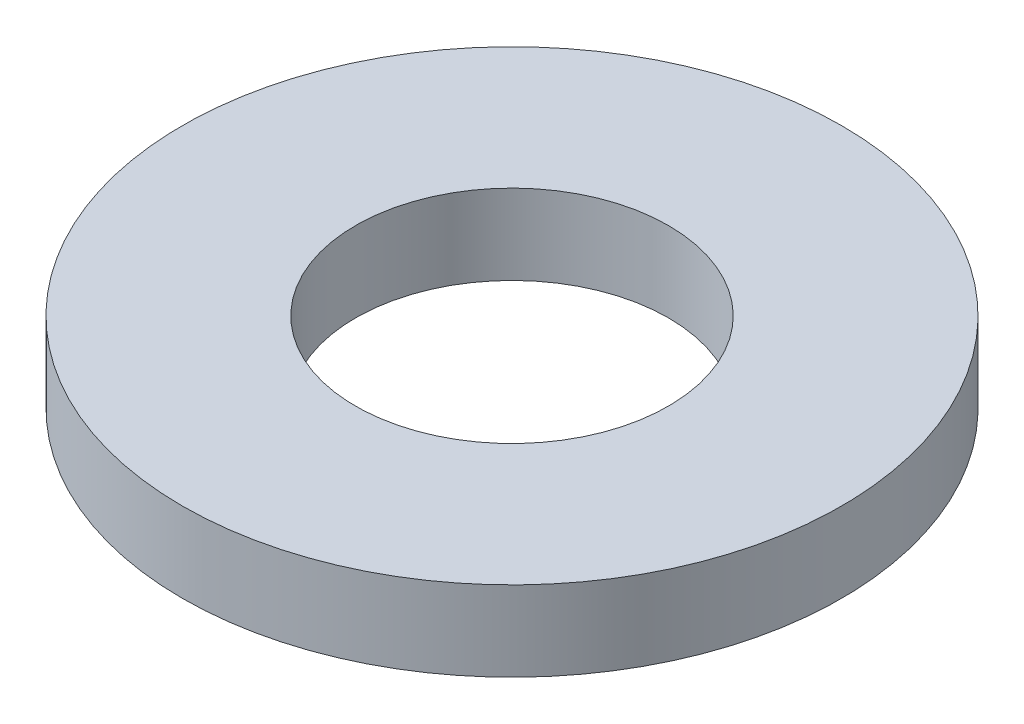
from build123d import *

# Parameters (mm, degrees)
SKETCH1_R           = 12.36
BOSS_EXTRUDE1_DEPTH = 3
SKETCH2_R           = 5.8674
CUT_EXTRUDE1_DEPTH  = 18.735253029


with BuildPart() as part:
    # Sketch1 → Boss-Extrude1 (new body)
    with BuildSketch(Plane(origin=(0, 0, 0), x_dir=(1, 0, 0), z_dir=(0, 1, 0))):
        with Locations(Location((0, 0, 0), (0, 0, 270))):
            Circle(SKETCH1_R)
    extrude(amount=BOSS_EXTRUDE1_DEPTH)

    # Sketch2 → Cut-Extrude1 (cut, through all)
    with BuildSketch(Plane(origin=(0, 0, 0), x_dir=(-1, 0, 0), z_dir=(0, -1, 0))):
        with Locations(Location((0, 0, 0), (0, 0, 90))):
            Circle(SKETCH2_R)
    extrude(amount=-CUT_EXTRUDE1_DEPTH, mode=Mode.SUBTRACT)


solid = part.part
